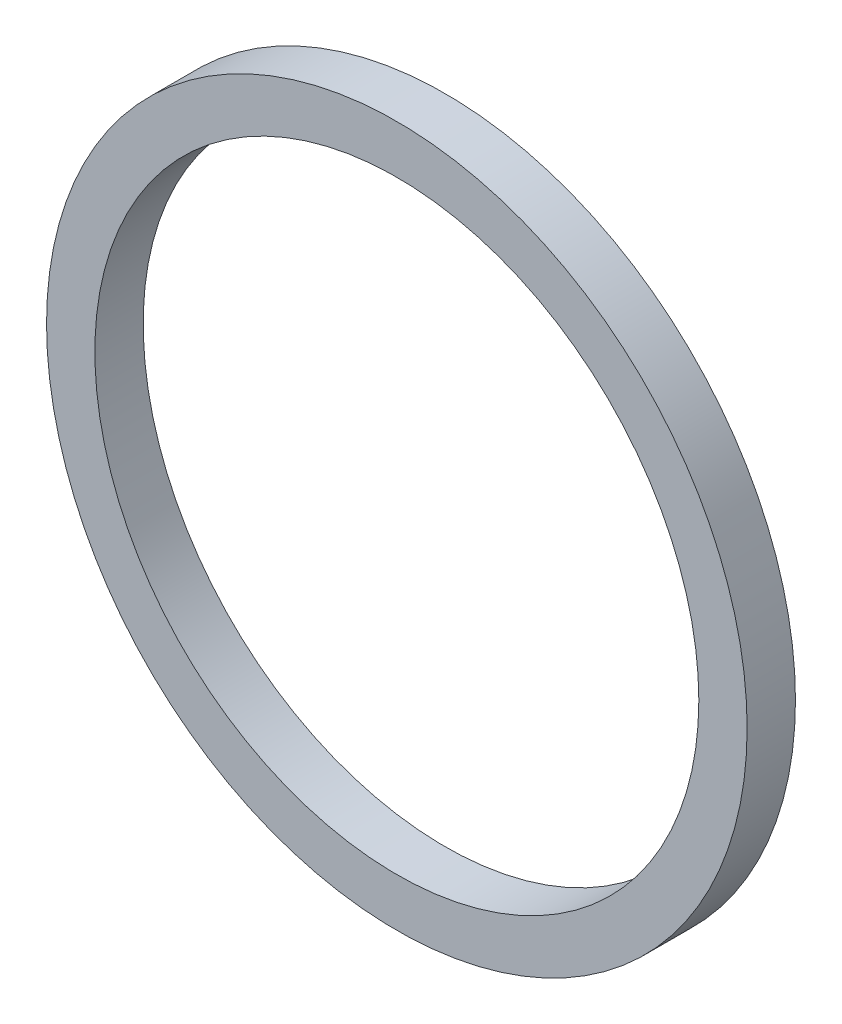
from build123d import *

# Parameters (mm, degrees)
SKETCH1_R           = 14.5
SKETCH1_R_2         = 12.5
BOSS_EXTRUDE1_DEPTH = 2


with BuildPart() as part:
    # Sketch1 → Boss-Extrude1 (new body)
    with BuildSketch(Plane.XY):
        Circle(SKETCH1_R)
        Circle(SKETCH1_R_2, mode=Mode.SUBTRACT)
    extrude(amount=BOSS_EXTRUDE1_DEPTH)


solid = part.part
